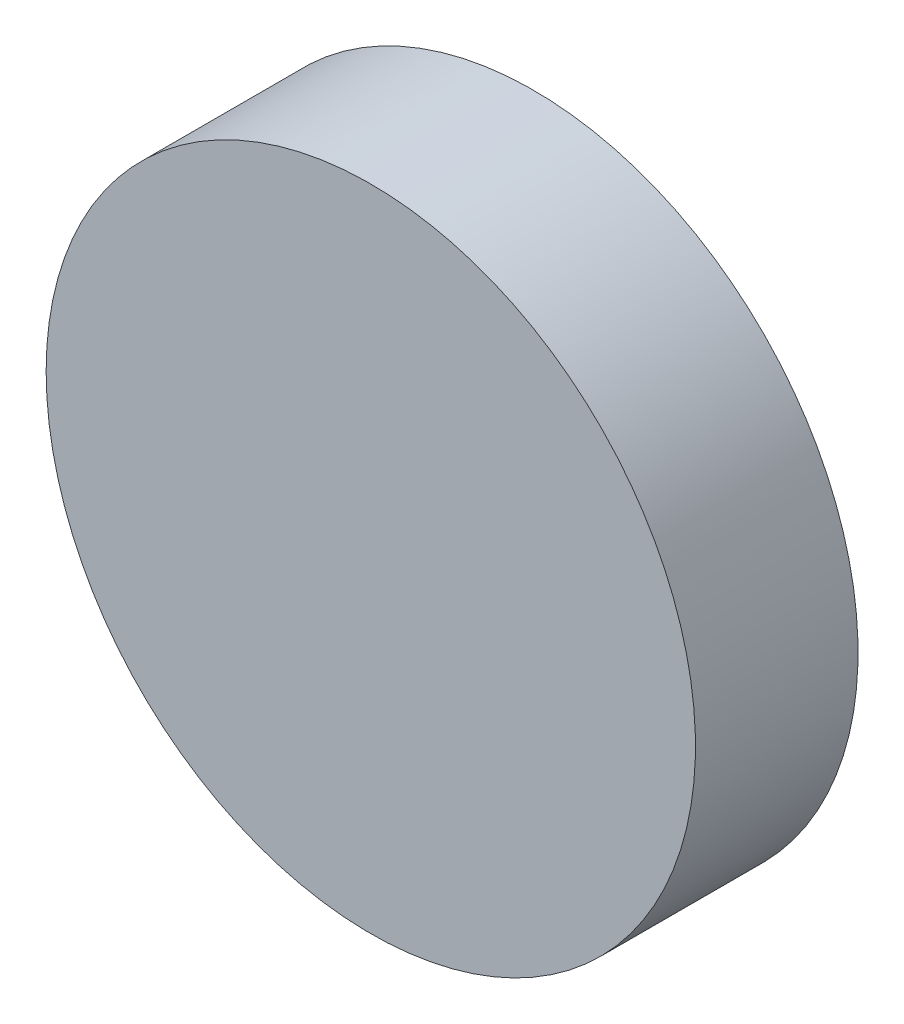
from build123d import *

# Parameters (mm, degrees)
SKETCH2_R           = 3.175
BOSS_EXTRUDE1_DEPTH = 1.59


with BuildPart() as part:
    # Sketch2 → Boss-Extrude1 (new body)
    with BuildSketch(Plane.XY):
        with Locations(Location((0, 0, 0), (0, 0, 180))):
            Circle(SKETCH2_R)
    extrude(amount=BOSS_EXTRUDE1_DEPTH)


solid = part.part
